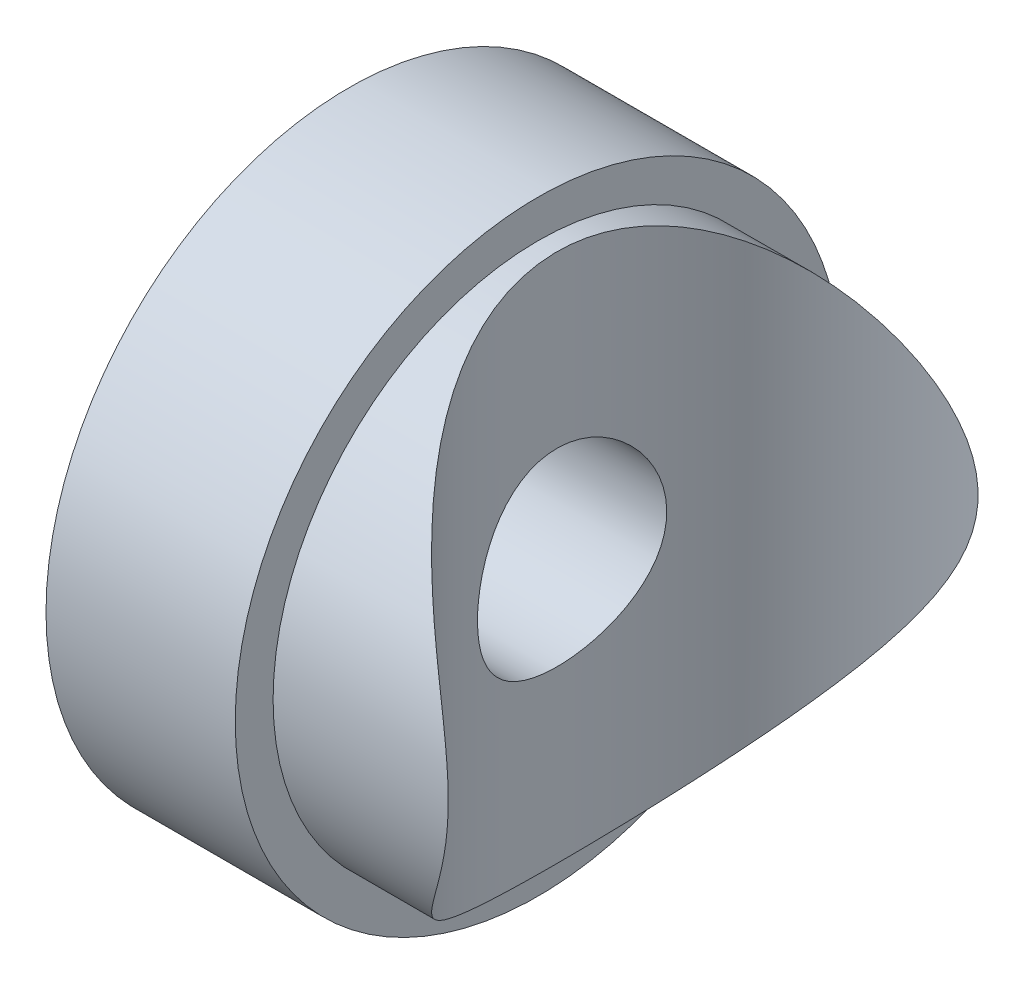
from build123d import *

# Parameters (mm, degrees)
SKETCH1_R               = 8
BOSS_EXTRUDE1_DEPTH     = 5
SKETCH2_R               = 7
BOSS_EXTRUDE2_DEPTH     = 5
CUT_EXTRUDE1_DEPTH      = 16.099668871
CUT_EXTRUDE1_DEPTH_BACK = 15
SKETCH3_R               = 8
SKETCH4_R               = 2.5
CUT_EXTRUDE2_DEPTH      = 15


with BuildPart() as part:
    # Sketch1 → Boss-Extrude1 (new body)
    with BuildSketch(Plane(origin=(0, 0, 0), x_dir=(0, 0, -1), z_dir=(1, 0, 0))):
        Circle(SKETCH1_R)
    extrude(amount=BOSS_EXTRUDE1_DEPTH)

    # Sketch2 → Boss-Extrude2 (add)
    with BuildSketch(Plane(origin=(5, 0, 0), x_dir=(0, 0, -1), z_dir=(1, 0, 0))):
        Circle(SKETCH2_R)
    extrude(amount=BOSS_EXTRUDE2_DEPTH)

    # Sketch3 → Cut-Extrude1 (cut, two sides: drawn at the far end of the back side and taken through both)
    with BuildSketch(Plane(origin=(0, 0, 0), x_dir=(1, 0, 0), z_dir=(0, 1, 0)).offset(-CUT_EXTRUDE1_DEPTH_BACK)):
        with Locations((13.5, 0)):
            Circle(SKETCH3_R)
    extrude(amount=CUT_EXTRUDE1_DEPTH + CUT_EXTRUDE1_DEPTH_BACK, mode=Mode.SUBTRACT)

    # Sketch4 → Cut-Extrude2 (cut)
    with BuildSketch(Plane.ZY):
        Circle(SKETCH4_R)
    extrude(amount=-CUT_EXTRUDE2_DEPTH, mode=Mode.SUBTRACT)


solid = part.part
